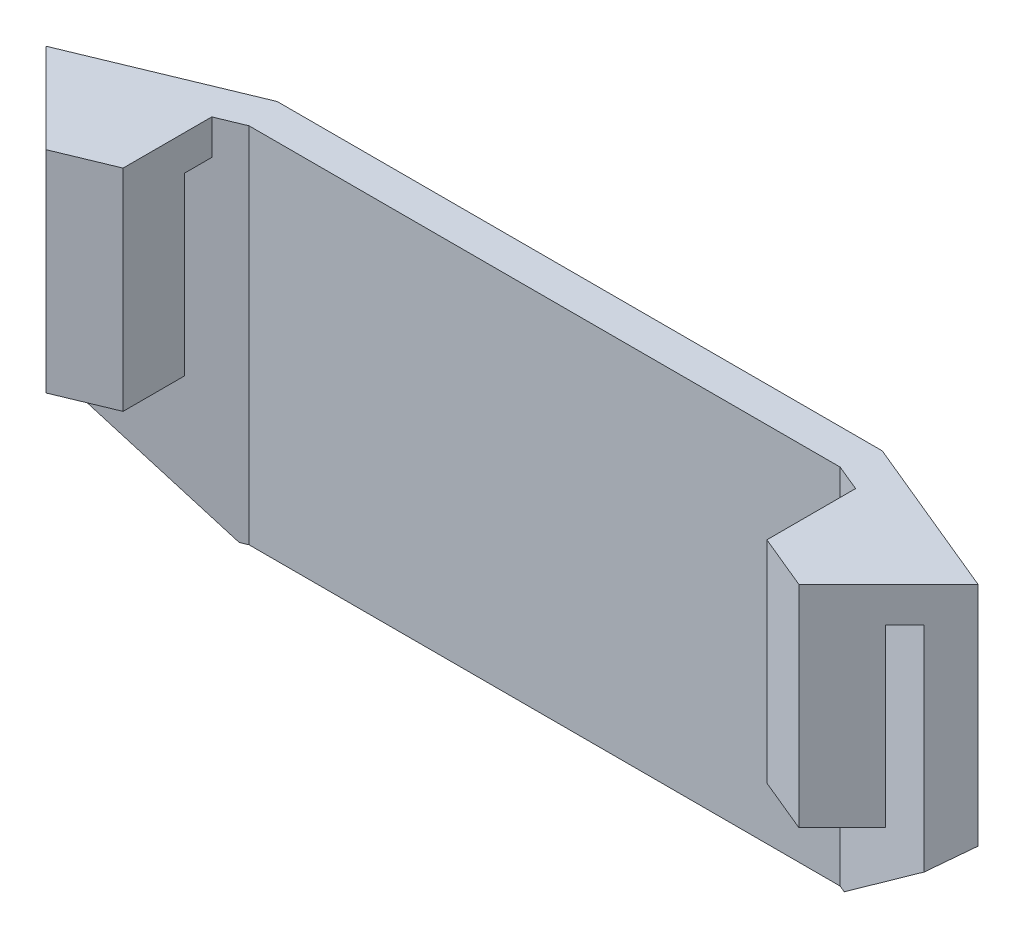
from build123d import *

# Parameters (mm, degrees)
BOSS_EXTRUDE1_DEPTH = 3
BOSS_EXTRUDE2_DEPTH = 28
CUT_EXTRUDE1_DEPTH  = 30
CUT_EXTRUDE2_DEPTH  = 30
CUT_EXTRUDE3_REACH  = 55.204
CUT_EXTRUDE4_DEPTH  = 31
BOSS_EXTRUDE3_DEPTH = 15


with BuildPart() as part:
    # Sketch2 → Boss-Extrude1 (new body)
    with BuildSketch(Plane(origin=(0, 0, 0), x_dir=(1, 0, 0), z_dir=(0, 1, 0))):
        Polygon((-27.25, -8.405172527), (-27.25, -0.828427125), (-25.25, 0), (25.25, 0), (27.25, -0.828427125), (27.25, -8.405172527), (36.155887914, -12.094112086), (41.513455967, -6.736544033), (41.513455967, -3.489367432), (25.846737102, 3), (-25.846737102, 3), (-41.513455967, -3.489367432), (-41.513455967, -6.736544033), (-36.155887914, -12.094112086), align=None)
    extrude(amount=BOSS_EXTRUDE1_DEPTH)

    # Sketch3 → Boss-Extrude2 (add)
    with BuildSketch(Plane.XZ):
        Polygon((-41.513455967, 6.736544033), (-25.25, 0), (25.25, 0), (41.513455967, 6.736544033), (41.513455967, 3.489367432), (25.846737102, -3), (-25.846737102, -3), (-41.513455967, 3.489367432), align=None)
    extrude(amount=BOSS_EXTRUDE2_DEPTH)

    # Sketch4 → Cut-Extrude1 (cut, along a direction that is not the sketch's normal)
    with BuildSketch(Plane(origin=(-4.845827185, 0, -11.69886171), x_dir=(-0.9238795325112868, 0, 0.38268343236508967), z_dir=(-0.3826834323650896, 0, -0.9238795325112867))):
        Polygon((40.931396085, -14), (22.731221094, -28), (40.931396085, -28), align=None)
    extrude(amount=-CUT_EXTRUDE1_DEPTH, dir=(0, 0, -1), mode=Mode.SUBTRACT)

    # Sketch5 → Cut-Extrude2 (cut, along a direction that is not the sketch's normal)
    with BuildSketch(Plane(origin=(4.845827185, 0, -11.69886171), x_dir=(-0.923879532511309, 0, -0.3826834323650361), z_dir=(0.38268343236503605, 0, -0.9238795325113089))):
        Polygon((-40.931396085, -14), (-22.731221094, -28), (-40.931396085, -28), align=None)
    extrude(amount=-CUT_EXTRUDE2_DEPTH, dir=(0, 0, -1), mode=Mode.SUBTRACT)

    # Cut-Extrude3: up to this face of the body (flat: up to its plane)
    cut_extrude3_end = Plane(part.part.faces().sort_by_distance((0, -28, -1.498496392))[0])
    # Sketch6 → Cut-Extrude3 (cut, up to the picked face)
    with BuildSketch(Plane(origin=(0, 3, 0), x_dir=(1, 0, 0), z_dir=(0, 1, 0)), mode=Mode.PRIVATE) as cut_extrude3_sk1:
        Polygon((-39.809556561, -2.783589189), (-32.155887914, -10.437257836), (-36.155887914, -12.094112086), (-41.513455967, -6.736544033), (-41.513455967, -3.489367432), align=None)
    cut_extrude3_tool1 = split(extrude(cut_extrude3_sk1.sketch, amount=-CUT_EXTRUDE3_REACH, mode=Mode.PRIVATE), bisect_by=cut_extrude3_end, keep=Keep.BOTH, mode=Mode.PRIVATE)
    # Sketch6 → Cut-Extrude3 (cut, up to the picked face)
    with BuildSketch(Plane(origin=(0, 3, 0), x_dir=(1, 0, 0), z_dir=(0, 1, 0)), mode=Mode.PRIVATE) as cut_extrude3_sk2:
        Polygon((39.809556561, -2.783589189), (32.155887914, -10.437257836), (36.155887914, -12.094112086), (41.513455967, -6.736544033), (41.513455967, -3.489367432), align=None)
    cut_extrude3_tool2 = split(extrude(cut_extrude3_sk2.sketch, amount=-CUT_EXTRUDE3_REACH, mode=Mode.PRIVATE), bisect_by=cut_extrude3_end, keep=Keep.BOTH, mode=Mode.PRIVATE)
    add(cut_extrude3_tool1.solids().sort_by(Axis((-37.57796, 3, 7.679108), (0, -1, 0)))[0], mode=Mode.SUBTRACT)
    add(cut_extrude3_tool2.solids().sort_by(Axis((37.57796, 3, 7.679108), (0, -1, 0)))[0], mode=Mode.SUBTRACT)

    # Sketch7 → Cut-Extrude4 (cut)
    with BuildSketch(Plane(origin=(0, 3, 0), x_dir=(1, 0, 0), z_dir=(0, 1, 0))):
        Polygon((-25.25, 0), (-27.5, -0.931980515), (-27.5, -8.508725917), (27.5, -8.508725917), (27.5, -0.931980515), (25.25, 0), align=None)
    extrude(amount=-CUT_EXTRUDE4_DEPTH, mode=Mode.SUBTRACT)

    # Sketch8 → Boss-Extrude3 (add)
    with BuildSketch(Plane.XZ):
        Polygon((-32.155887914, 10.437257836), (-27.5, 8.508725917), (-27.5, 3.259123746), (-35.867917208, 6.725228542), align=None)
        Polygon((27.5, 3.259123746), (35.867917208, 6.725228542), (32.155887914, 10.437257836), (27.5, 8.508725917), align=None)
    extrude(amount=BOSS_EXTRUDE3_DEPTH)


solid = part.part
